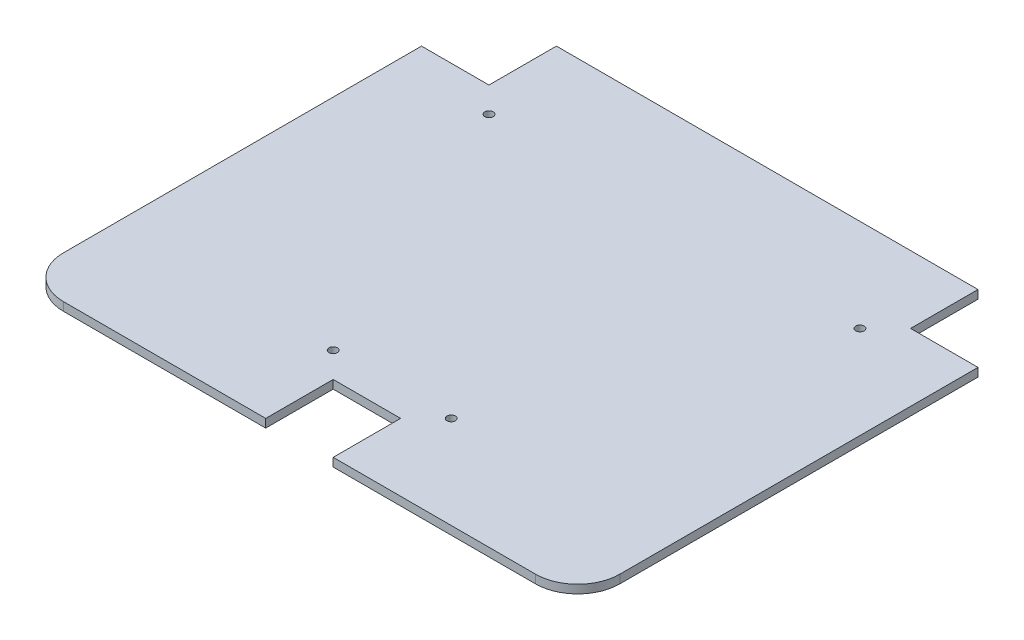
from build123d import *

# Parameters (mm, degrees)
RESSALTO_EXTRUS_O4_DEPTH = 5
ESBO_O2_R                = 2.5
CORTE_EXTRUS_O1_DEPTH    = 5


with BuildPart() as part:
    # Esboço1 → Ressalto-extrusão4 (new body)
    with BuildSketch(Plane(origin=(0, 0, 0), x_dir=(1, 0, 0), z_dir=(0, 1, 0))):
        with BuildLine():
            Line((516.267355398, -155.796995794), (396.267355398, -155.796995794))
            ThreePointArc((396.267355398, -155.796995794), (378.589685869, -148.474665324), (371.267355398, -130.796995794))
            Line((371.267355398, -130.796995794), (371.267355398, 81.588187759))
            Line((371.267355398, 81.588187759), (411.267355398, 81.588187759))
            Line((411.267355398, 81.588187759), (411.267355398, 121.588187759))
            Line((411.267355398, 121.588187759), (661.267355398, 121.588187759))
            Line((661.267355398, 121.588187759), (661.267355398, 81.588187759))
            Line((661.267355398, 81.588187759), (701.267355398, 81.588187759))
            Line((701.267355398, 81.588187759), (701.267355398, -130.796995794))
            ThreePointArc((701.267355398, -130.796995794), (693.945024928, -148.474665324), (676.267355398, -155.796995794))
            Line((676.267355398, -155.796995794), (556.267355398, -155.796995794))
            Line((556.267355398, -155.796995794), (556.267355398, -115.796995794))
            Line((556.267355398, -115.796995794), (516.267355398, -115.796995794))
            Line((516.267355398, -115.796995794), (516.267355398, -155.796995794))
        make_face()
    extrude(amount=RESSALTO_EXTRUS_O4_DEPTH)

    # Esboço2 → Corte-extrusão1 (cut)
    with BuildSketch(Plane(origin=(0, 5, 0), x_dir=(1, 0, 0), z_dir=(0, 1, 0))):
        with Locations(Location((571.267355398, -100.796995794, 0), (0, 0, 270))):
            Circle(ESBO_O2_R)
        with Locations(Location((501.267355398, -100.796995794, 0), (0, 0, 270))):
            Circle(ESBO_O2_R)
        with Locations(Location((646.267355398, 66.588187759, 0), (0, 0, 270))):
            Circle(ESBO_O2_R)
        with Locations(Location((426.267355398, 66.588187759, 0), (0, 0, 270))):
            Circle(ESBO_O2_R)
    extrude(amount=-CORTE_EXTRUS_O1_DEPTH, mode=Mode.SUBTRACT)


solid = part.part
